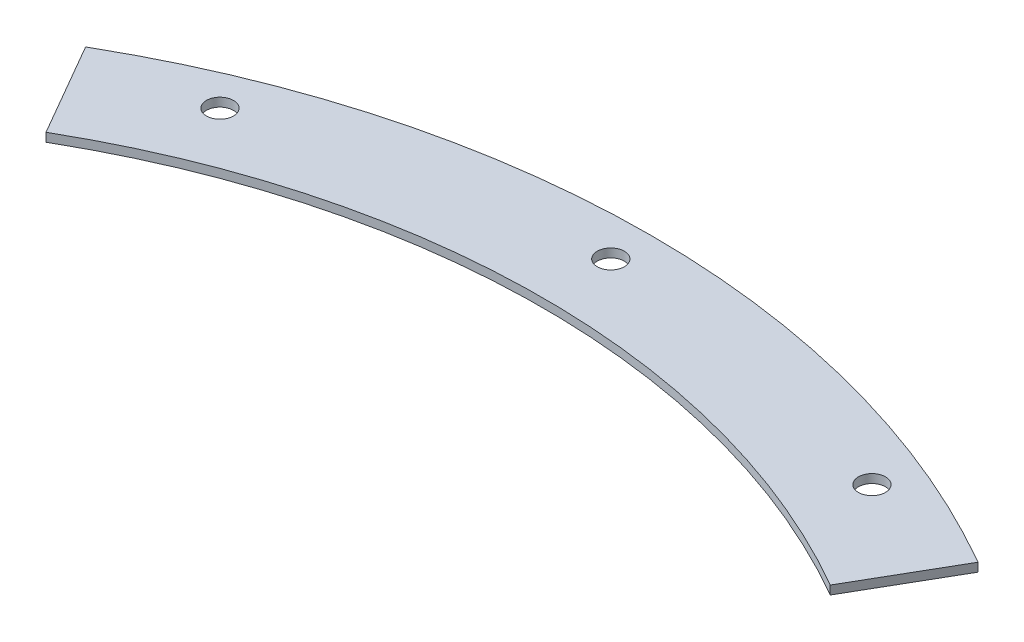
from build123d import *

# Parameters (mm, degrees)
BOSS_EXTRUDE1_DEPTH = 1.6
SKETCH2_R           = 2.5
CUT_EXTRUDE1_DEPTH  = 10


with BuildPart() as part:
    # Sketch1 → Boss-Extrude1 (new body)
    with BuildSketch(Plane(origin=(0, 0, 0), x_dir=(1, 0, 0), z_dir=(0, 1, 0))):
        with BuildLine():
            Line((-72.50000105, 125.573685367), (-82.50000105, 142.894193443))
            ThreePointArc((-82.50000105, 142.894193443), (0, 165.0000021), (82.50000105, 142.894193443))
            Line((82.50000105, 142.894193443), (72.50000105, 125.573685367))
            ThreePointArc((72.50000105, 125.573685367), (0, 145.0000021), (-72.50000105, 125.573685367))
        make_face()
    extrude(amount=BOSS_EXTRUDE1_DEPTH)

    # Sketch2 → Cut-Extrude1 (cut)
    with BuildSketch(Plane.XZ):
        with Locations(Location((-60.272640598, -145.511026371, 0), (0, 0, 270))):
            Circle(SKETCH2_R)
        with Locations(Location((0, -157.5, 0), (0, 0, 270))):
            Circle(SKETCH2_R)
        with Locations(Location((60.272640598, -145.511026371, 0), (0, 0, 270))):
            Circle(SKETCH2_R)
    extrude(amount=-CUT_EXTRUDE1_DEPTH, mode=Mode.SUBTRACT)


solid = part.part
